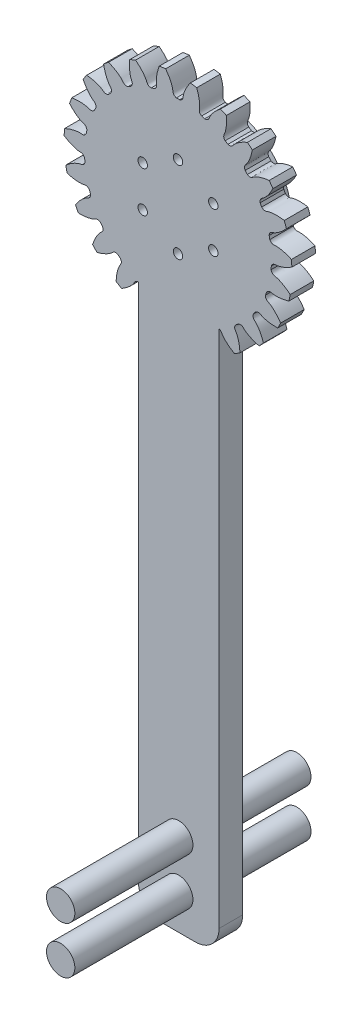
from build123d import *

# Parameters (mm, degrees)
SKETCH_1_R               = 48.25
EXTRUDE_1_DEPTH          = 10
CUT_EXTRUDE_1_DEPTH      = 69.964664865
PATTERN_CIRCULAR_1_COUNT = 23
SKETCH_5_W               = 34.161088376
SKETCH_5_H               = 266
EXTRUDE_5_DEPTH          = 10
SKETCH_6_R               = 2
CUT_EXTRUDE_3_DEPTH      = 169
SKETCH_7_R               = 29.5
EXTRUDE_6_DEPTH          = 8.85
CUT_EXTRUDE_START        = -66
SKETCH_8_R               = 2
CUT_EXTRUDE_4_DEPTH      = 66
SKETCH_14_R              = 6
EXTRUDE_8_DEPTH          = 50
FILLET_1_R               = 10
FILLET_2_R               = 10


with BuildPart() as part:
    # 草图1 → 凸台-拉伸1 (new body)
    with BuildSketch(Plane.XY):
        Circle(SKETCH_1_R)
    extrude(amount=EXTRUDE_1_DEPTH)

    # 草图2 → 切除-拉伸1 (cut, through all)
    with BuildSketch(Plane.XY):
        with BuildLine():
            ThreePointArc((0.700117739, 39.55880509), (0, 39.565), (-0.700117739, 39.55880509))
            add(Edge.make_bspline(
                [(-0.700117739, 39.55880509), (-2.230051257, 40.01570508), (-2.098914789, 41.046611477), (-2.288709546, 42.06309924), (-2.314061981, 42.185649143), (-2.345575626, 42.323935079), (-2.383864932, 42.47775829), (-2.429569872, 42.646894953), (-2.483314136, 42.831104069), (-2.54571772, 43.030125172), (-2.617392338, 43.243679276), (-2.698942172, 43.471468827), (-2.790963, 43.713177983), (-2.894041818, 43.968472807), (-3.008756324, 44.237001499), (-3.135674445, 44.518394641), (-3.275353865, 44.812265445), (-3.428341558, 45.118210016), (-3.595173329, 45.435807635), (-3.776373358, 45.764621039), (-3.972453757, 46.104196727), (-4.183914129, 46.454065263), (-4.411241138, 46.813741602), (-4.654908088, 47.182725423), (-4.915374502, 47.560501466), (-5.193085722, 47.946539892), (-5.488472508, 48.340296641), (-5.801950649, 48.741213807), (-6.133920582, 49.148720026), (-6.484767024, 49.562230859), (-6.85485861, 49.981149205), (-7.244547542, 50.404865706), (-7.654169248, 50.832759169), (-8.08404205, 51.264196994), (-8.534466847, 51.698535616), (-9.005726803, 52.135120945), (-9.498087043, 52.573288825), (-10.011794403, 53.012365488), (-10.547076998, 53.451668039), (-11.298572056, 54.043667554), (-11.882201151, 54.475393164), (-12.281287755, 54.75871483)],
                knots=[0, 0, 0, 0, 0.147386897, 0.152959532, 0.159389495, 0.166676786, 0.174821406, 0.183823355, 0.193682632, 0.204399237, 0.21597317, 0.228404432, 0.241693023, 0.255838942, 0.270842189, 0.286702764, 0.303420668, 0.320995901, 0.339428462, 0.358718351, 0.378865568, 0.399870114, 0.421731989, 0.444451192, 0.468027723, 0.492461582, 0.517752771, 0.543901287, 0.570907132, 0.598770305, 0.627490807, 0.657068637, 0.687503795, 0.718796282, 0.750946098, 0.783953241, 0.817817713, 0.852539514, 0.888118643, 0.9245551, 1, 1, 1, 1], degree=3))
            ThreePointArc((-12.281287755, 54.75871483), (0, 56.119042034), (12.281287755, 54.75871483))
            add(Edge.make_bspline(
                [(0.700117739, 39.55880509), (2.230051257, 40.01570508), (2.098914789, 41.046611477), (2.288709546, 42.06309924), (2.314061981, 42.185649143), (2.345575626, 42.323935079), (2.383864932, 42.47775829), (2.429569872, 42.646894953), (2.483314136, 42.831104069), (2.54571772, 43.030125172), (2.617392338, 43.243679276), (2.698942172, 43.471468827), (2.790963, 43.713177983), (2.894041818, 43.968472807), (3.008756324, 44.237001499), (3.135674445, 44.518394641), (3.275353865, 44.812265445), (3.428341558, 45.118210016), (3.595173329, 45.435807635), (3.776373358, 45.764621039), (3.972453757, 46.104196727), (4.183914129, 46.454065263), (4.411241138, 46.813741602), (4.654908088, 47.182725423), (4.915374502, 47.560501466), (5.193085722, 47.946539892), (5.488472508, 48.340296641), (5.801950649, 48.741213807), (6.133920582, 49.148720026), (6.484767024, 49.562230859), (6.85485861, 49.981149205), (7.244547542, 50.404865706), (7.654169248, 50.832759169), (8.08404205, 51.264196994), (8.534466847, 51.698535616), (9.005726803, 52.135120945), (9.498087043, 52.573288825), (10.011794403, 53.012365488), (10.547076998, 53.451668039), (11.298572056, 54.043667554), (11.882201151, 54.475393164), (12.281287755, 54.75871483)],
                knots=[0, 0, 0, 0, 0.147386897, 0.152959532, 0.159389495, 0.166676786, 0.174821406, 0.183823355, 0.193682632, 0.204399237, 0.21597317, 0.228404432, 0.241693023, 0.255838942, 0.270842189, 0.286702764, 0.303420668, 0.320995901, 0.339428462, 0.358718351, 0.378865568, 0.399870114, 0.421731989, 0.444451192, 0.468027723, 0.492461582, 0.517752771, 0.543901287, 0.570907132, 0.598770305, 0.627490807, 0.657068637, 0.687503795, 0.718796282, 0.750946098, 0.783953241, 0.817817713, 0.852539514, 0.888118643, 0.9245551, 1, 1, 1, 1], degree=3))
        make_face()
    cut_extrude_1 = extrude(amount=CUT_EXTRUDE_1_DEPTH, mode=Mode.SUBTRACT)

    # 阵列(圆周)1: 切除-拉伸1 ×23 about axis
    pattern_circular_1_axis = Axis((0, 0, -1.5), (0, 0, 1))
    for i in range(1, PATTERN_CIRCULAR_1_COUNT):
        add(cut_extrude_1.rotate(pattern_circular_1_axis, i * 360 / PATTERN_CIRCULAR_1_COUNT), mode=Mode.SUBTRACT)

    # 草图5 → 凸台-拉伸5 (add)
    with BuildSketch(Plane.XY.offset(10)):
        with Locations((0.317926578, -133)):
            Rectangle(SKETCH_5_W, SKETCH_5_H)
    extrude(amount=-EXTRUDE_5_DEPTH)

    # 草图6 → 切除-拉伸3 (cut)
    with BuildSketch(Plane.XY.offset(10)):
        with Locations((0, 17.25)):
            Circle(SKETCH_6_R)
        with Locations((14.938938215, 8.625)):
            Circle(SKETCH_6_R)
        with Locations((14.938938215, -8.625)):
            Circle(SKETCH_6_R)
        with Locations((0, -17.25)):
            Circle(SKETCH_6_R)
        with Locations((-14.938938215, -8.625)):
            Circle(SKETCH_6_R)
        with Locations((-14.938938215, 8.625)):
            Circle(SKETCH_6_R)
    extrude(amount=-CUT_EXTRUDE_3_DEPTH, mode=Mode.SUBTRACT)

    # 草图7 → 凸台-拉伸6 (add)
    with BuildSketch(Plane(origin=(0, 0, 0), x_dir=(-1, 0, 0), z_dir=(0, 0, -1))):
        with Locations(Location((0, 0, 0), (0, 0, 180))):
            Circle(SKETCH_7_R)
    extrude(amount=EXTRUDE_6_DEPTH)

    # 草图8 → 切除-拉伸4 (cut)
    with BuildSketch(Plane(origin=(0, 0, -8.85), x_dir=(-1, 0, 0), z_dir=(0, 0, -1)).offset(CUT_EXTRUDE_START)):
        with Locations(Location((0, 17.25, 0), (0, 0, 180))):
            Circle(SKETCH_8_R)
        with Locations(Location((14.938938215, 8.625, 0), (0, 0, 180))):
            Circle(SKETCH_8_R)
        with Locations(Location((14.938938215, -8.625, 0), (0, 0, 180))):
            Circle(SKETCH_8_R)
        with Locations(Location((0, -17.25, 0), (0, 0, 180))):
            Circle(SKETCH_8_R)
        with Locations(Location((-14.938938215, -8.625, 0), (0, 0, 180))):
            Circle(SKETCH_8_R)
        with Locations(Location((-14.938938215, 8.625, 0), (0, 0, 180))):
            Circle(SKETCH_8_R)
    extrude(amount=CUT_EXTRUDE_4_DEPTH, mode=Mode.SUBTRACT)

    # 草图14 → 凸台-拉伸8 (add, symmetric)
    with BuildSketch(Plane.XY.offset(10)):
        with Locations((0.317926578, -251)):
            Circle(SKETCH_14_R)
        with Locations((0.317926578, -231)):
            Circle(SKETCH_14_R)
    extrude(amount=EXTRUDE_8_DEPTH, both=True)

    # 圆角1
    fillet_1_edges = [part.edges().sort_by_distance(p)[0] for p in [
        (17.398470766, -266, 5),
    ]]
    fillet(fillet_1_edges, radius=FILLET_1_R)

    # 圆角2
    fillet_2_edges = [part.edges().sort_by_distance(p)[0] for p in [
        (-16.76261761, -266, 5),
    ]]
    fillet(fillet_2_edges, radius=FILLET_2_R)


solid = part.part
